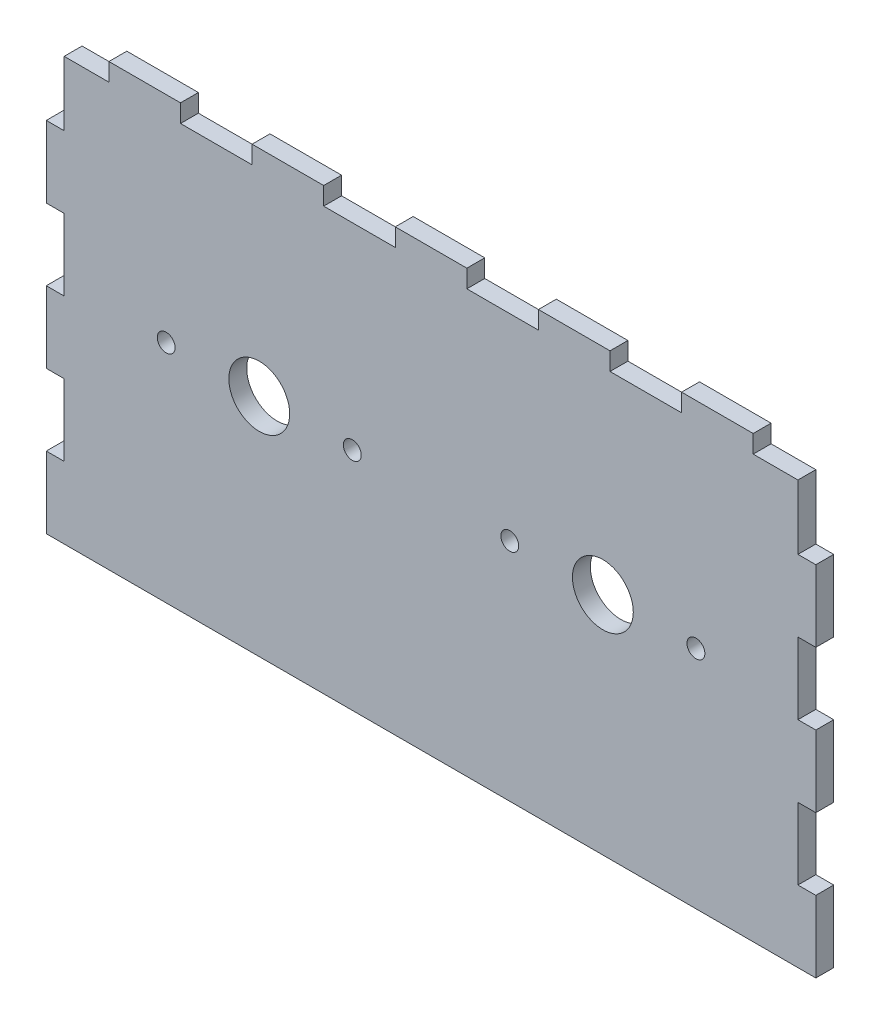
from build123d import *

# Parameters (mm, degrees)
SKETCH_1_W               = 205
SKETCH_1_H               = 118
SKETCH_1_R               = 8.5
SKETCH_1_R_2             = 2.5
EXTRUDE_1_DEPTH          = 5
SKETCH_2_W               = 5
SKETCH_2_H               = 20
EXTRUDE_2_DEPTH          = 5
PATTERN_LINEAR_1_COUNT   = 3
PATTERN_LINEAR_1_PITCH   = 40
MIRROR_1_COPY_1_SKETCH_W = 5
MIRROR_1_COPY_1_SKETCH_H = 20
MIRROR_1_COPY_1_DEPTH    = 5
MIRROR_1_COPY_2_SKETCH_W = 5
MIRROR_1_COPY_2_SKETCH_H = 20
MIRROR_1_COPY_2_DEPTH    = 5
SKETCH_3_W               = 20
SKETCH_3_H               = 5
EXTRUDE_3_DEPTH          = 5
PATTERN_LINEAR_2_COUNT   = 3
PATTERN_LINEAR_2_PITCH   = 40
PATTERN_LINEAR_3_COUNT   = 3
PATTERN_LINEAR_3_PITCH   = 40


with BuildPart() as part:
    # 스케치1 → 보스-돌출1 (new body)
    with BuildSketch(Plane.XY):
        Rectangle(SKETCH_1_W, SKETCH_1_H)
        with Locations((48, 4)):
            Circle(SKETCH_1_R, mode=Mode.SUBTRACT)
        with Locations((-48, 4)):
            Circle(SKETCH_1_R, mode=Mode.SUBTRACT)
        with Locations((-74, 4)):
            Circle(SKETCH_1_R_2, mode=Mode.SUBTRACT)
        with Locations(Location((-22, 4, 0), (0, 0, 180))):
            Circle(SKETCH_1_R_2, mode=Mode.SUBTRACT)
        with Locations((22, 4)):
            Circle(SKETCH_1_R_2, mode=Mode.SUBTRACT)
        with Locations(Location((74, 4, 0), (0, 0, 180))):
            Circle(SKETCH_1_R_2, mode=Mode.SUBTRACT)
    extrude(amount=EXTRUDE_1_DEPTH)

    # 스케치2 → 보스-돌출2 (add)
    with BuildSketch(Plane.XY.offset(5)):
        with Locations((-105, -49)):
            Rectangle(SKETCH_2_W, SKETCH_2_H)
    extrude_2 = extrude(amount=-EXTRUDE_2_DEPTH)

    # 선형 패턴1: 보스-돌출2 ×3
    with Locations(*[(0, i * PATTERN_LINEAR_1_PITCH, 0) for i in range(1, PATTERN_LINEAR_1_COUNT)]):
        add(extrude_2)

    # 대칭 복사1: 보스-돌출2 across plane
    add(extrude_2.mirror(Plane(origin=(0, 0, 0), x_dir=(0, 0, 1), z_dir=(1, 0, 0))))

    # 대칭 복사1 copy 1 sketch → 대칭 복사1 copy 1 (add)
    with BuildSketch(Plane(origin=(0, 40, 5), x_dir=(-1, 0, 0), z_dir=(0, 0, 1))):
        with Locations((-105, 49)):
            Rectangle(MIRROR_1_COPY_1_SKETCH_W, MIRROR_1_COPY_1_SKETCH_H)
    extrude(amount=-MIRROR_1_COPY_1_DEPTH)

    # 대칭 복사1 copy 2 sketch → 대칭 복사1 copy 2 (add)
    with BuildSketch(Plane(origin=(0, 80, 5), x_dir=(-1, 0, 0), z_dir=(0, 0, 1))):
        with Locations((-105, 49)):
            Rectangle(MIRROR_1_COPY_2_SKETCH_W, MIRROR_1_COPY_2_SKETCH_H)
    extrude(amount=-MIRROR_1_COPY_2_DEPTH)

    # 스케치3 → 보스-돌출3 (add)
    with BuildSketch(Plane.XY.offset(5)):
        with Locations((0, 61.5)):
            Rectangle(SKETCH_3_W, SKETCH_3_H)
    extrude_3 = extrude(amount=-EXTRUDE_3_DEPTH)

    # 선형 패턴2: 보스-돌출3 ×3
    with Locations(*[(i * PATTERN_LINEAR_2_PITCH, 0, 0) for i in range(1, PATTERN_LINEAR_2_COUNT)]):
        add(extrude_3)

    # 선형 패턴3: 보스-돌출3 ×3
    with Locations(*[(-i * PATTERN_LINEAR_3_PITCH, 0, 0) for i in range(1, PATTERN_LINEAR_3_COUNT)]):
        add(extrude_3)


solid = part.part
